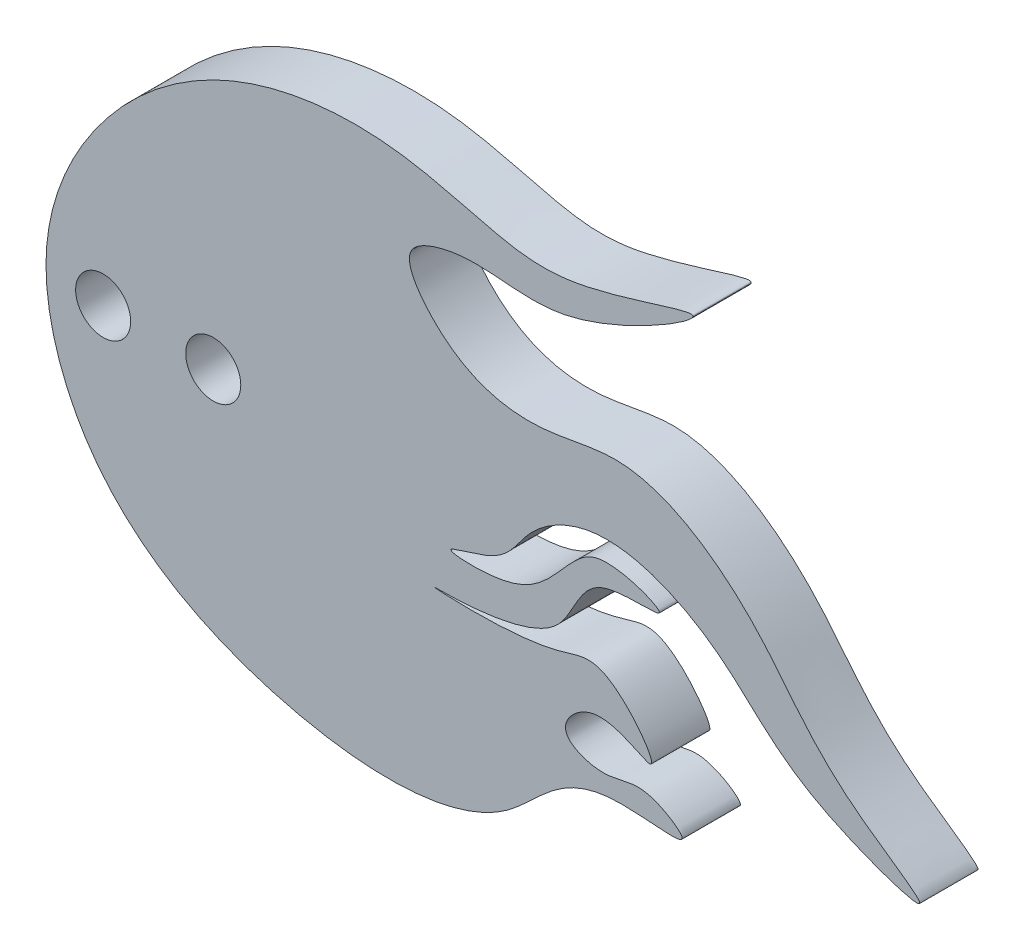
from build123d import *

# Parameters (mm, degrees)
BOSS_EXTRUDE1_DEPTH = 3.175
SKETCH3_R           = 1.5
CUT_EXTRUDE1_DEPTH  = 62.37230268


with BuildPart() as part:
    # Sketch2 → Boss-Extrude1 (new body)
    with BuildSketch(Plane.XY):
        with BuildLine():
            add(Edge.make_bspline(
                [(29.207742877, 35.717468465), (27.564230342, 35.509146655), (24.919454559, 36.016972128), (18.675330786, 37.787001413), (10.521477008, 36.720419145), (3.418926114, 30.870356855), (-0.131009111, 22.833731924), (3.032127162, 12.804646369), (13.131754602, 7.108100018), (25.667983502, 6.72133109), (29.496073861, 13.36660699), (37.148859705, 11.742591874), (33.302139018, 14.194546611), (31.493569826, 13.033363204), (28.300550831, 14.184690177), (31.010174373, 16.964671568), (35.542518471, 13.442109004), (31.459952472, 19.126468064), (27.732402605, 17.199216403), (17.651799953, 17.798062225), (29.601446249, 17.3321198), (29.88036881, 22.870169201), (36.358106017, 21.979655924), (31.376535738, 23.985359437), (28.825672017, 22.040552063), (27.59414406, 19.393242701), (21.358620703, 19.680519586), (25.910944792, 20.476812713), (27.047367717, 22.937935481), (31.399974657, 25.581450824), (38.163450521, 22.467212538), (41.218401011, 18.001230534), (51.025300464, 14.655783092), (42.905226398, 19.599883885), (40.283162315, 24.499536276), (33.575826986, 29.418071759), (27.285441507, 27.525137109), (22.867735551, 28.537445348), (19.902985476, 32.852384286), (24.399845195, 34.616984192), (28.580475887, 32.421311029), (40.195851031, 39.482629783), (31.993669435, 36.070595838), (29.207742877, 35.717468465)],
                knots=[0, 0, 0, 0, 0.019313564, 0.04109133, 0.08696025, 0.12625416, 0.16318102, 0.201007588, 0.258577406, 0.315726187, 0.345346931, 0.362814407, 0.373276152, 0.38407387, 0.394324389, 0.404232517, 0.41895678, 0.437984057, 0.449078381, 0.479473308, 0.510297217, 0.52897239, 0.543032431, 0.559123987, 0.565021038, 0.587261649, 0.600960417, 0.612435154, 0.624782143, 0.640444271, 0.67605118, 0.708184935, 0.734710062, 0.754186458, 0.791600097, 0.830668026, 0.849067141, 0.878547417, 0.892075492, 0.900936313, 0.931785361, 0.967261478, 1, 1, 1, 1], degree=3))
        make_face()
    extrude(amount=BOSS_EXTRUDE1_DEPTH)

    # Sketch3 → Cut-Extrude1 (cut, through all)
    with BuildSketch(Plane.XY.offset(3.175)):
        with Locations((4, 21.838222863)):
            Circle(SKETCH3_R)
        with Locations((10, 21.838222863)):
            Circle(SKETCH3_R)
    extrude(amount=-CUT_EXTRUDE1_DEPTH, mode=Mode.SUBTRACT)


solid = part.part
